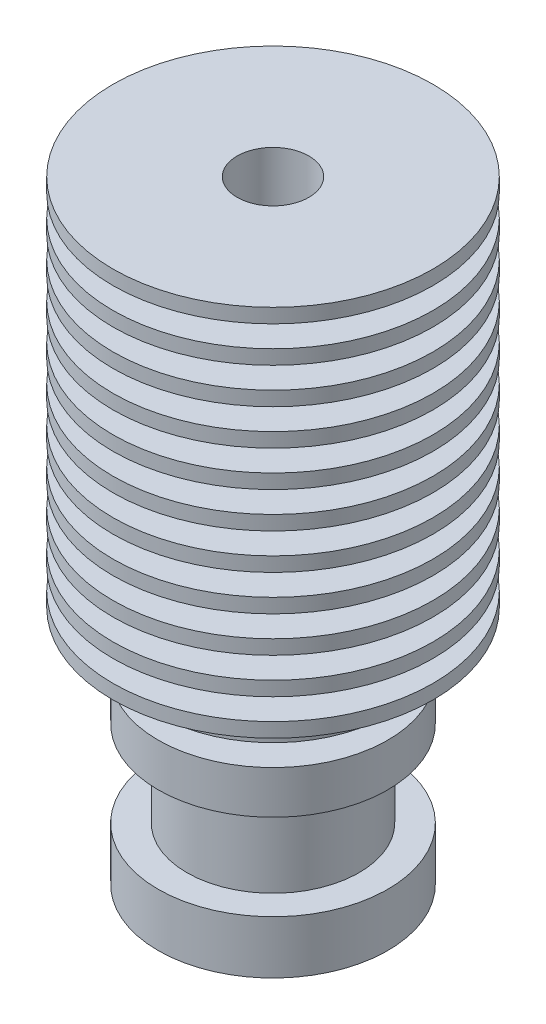
from build123d import *

# Parameters (mm, degrees)
ESQUISSE1_R                = 8
BOSS_EXTRU_1_DEPTH         = 3.7
ESQUISSE2_R                = 6
BOSS_EXTRU_2_DEPTH         = 6
ESQUISSE3_R                = 8
ESQUISSE3_R_2              = 3.25
BOSS_EXTRU_3_DEPTH         = 3
ESQUISSE4_R                = 4.5
BOSS_EXTRU_4_DEPTH         = 30
BOSS_EXTRU_4_DRAFT         = -3
ENL_V_MAT_EXTRU_1_REACH    = 46.173
ESQUISSE5_R                = 2.1
TROU_TARAUD_M61_D          = 5
TROU_TARAUD_M61_DEPTH      = 17.9
TROU_TARAUD_M61_TIP        = 1.502151548
ESQUISSE9_R                = 8
ESQUISSE9_R_2              = 4.25
BOSS_EXTRU_5_DEPTH         = 1
ESQUISSE10_R               = 11.15
ESQUISSE10_R_2             = 4.25
BOSS_EXTRU_6_DEPTH         = 1
R_P_TITION_LIN_AIRE1_COUNT = 11
R_P_TITION_LIN_AIRE1_PITCH = 2.5
TROU_TARAUD_M51_D          = 4.2
TROU_TARAUD_M51_DEPTH      = 12.4
TROU_TARAUD_M51_TIP        = 1.2618073


with BuildPart() as part:
    # Esquisse1 → Boss.-Extru.1 (new body)
    with BuildSketch(Plane(origin=(0, 0, 0), x_dir=(1, 0, 0), z_dir=(0, 1, 0))):
        with Locations(Location((0, 0, 0), (0, 0, 270))):
            Circle(ESQUISSE1_R)
    extrude(amount=BOSS_EXTRU_1_DEPTH)

    # Esquisse2 → Boss.-Extru.2 (add)
    with BuildSketch(Plane(origin=(0, 3.7, 0), x_dir=(1, 0, 0), z_dir=(0, 1, 0))):
        with Locations(Location((0, 0, 0), (0, 0, 270))):
            Circle(ESQUISSE2_R)
    extrude(amount=BOSS_EXTRU_2_DEPTH)

    # Esquisse3 → Boss.-Extru.3 (add)
    with BuildSketch(Plane(origin=(0, 9.7, 0), x_dir=(1, 0, 0), z_dir=(0, 1, 0))):
        with Locations(Location((0, 0, 0), (0, 0, 270))):
            Circle(ESQUISSE3_R)
        with Locations(Location((0, 0, 0), (0, 0, 270))):
            Circle(ESQUISSE3_R_2, mode=Mode.SUBTRACT)
    extrude(amount=BOSS_EXTRU_3_DEPTH)


with BuildPart() as boss_extru_4_tool:
    # Esquisse4 → Boss.-Extru.4 (with draft: the straight prism first)
    with BuildSketch(Plane(origin=(0, 12.7, 0), x_dir=(1, 0, 0), z_dir=(0, 1, 0))):
        Circle(ESQUISSE4_R)
    extrude(amount=BOSS_EXTRU_4_DEPTH)
    # Boss.-Extru.4: the draft: its side faces are tilted about the plane it starts from
    boss_extru_4_sides = [boss_extru_4_tool.faces().sort_by_distance(p)[0] for p in [
        (-4.5, 27.7, 0),
    ]]
    draft(boss_extru_4_sides, Plane(origin=(0, 12.7, 0), x_dir=(1, 0, 0), z_dir=(0, 1, 0)), BOSS_EXTRU_4_DRAFT)


with BuildPart() as part_1:
    add(part.part)

    # Boss.-Extru.4: add boss_extru_4_tool
    add(boss_extru_4_tool.part)

    # Esquisse5 → Enlèv. mat.-Extru.1 (cut, up to next)
    with BuildSketch(Plane(origin=(0, 42.7, 0), x_dir=(1, 0, 0), z_dir=(0, 1, 0)), mode=Mode.PRIVATE) as enl_v_mat_extru_1_sk1:
        with Locations(Location((0, 0, 0), (0, 0, 270))):
            Circle(ESQUISSE5_R)
    enl_v_mat_extru_1_tool1 = extrude(enl_v_mat_extru_1_sk1.sketch, amount=-ENL_V_MAT_EXTRU_1_REACH, mode=Mode.PRIVATE) & part_1.part
    add(enl_v_mat_extru_1_tool1.solids().sort_by_distance((0, 42.7, 0))[0], mode=Mode.SUBTRACT)

    # Trou taraudé M61
    with Locations(Plane(origin=(0, 42.7, 0), x_dir=(1, 0, 0), z_dir=(0, 1, 0))):
        with Locations((0, 0)):
            Hole(TROU_TARAUD_M61_D / 2, depth=TROU_TARAUD_M61_DEPTH)
            with Locations((0, 0, -(TROU_TARAUD_M61_DEPTH + TROU_TARAUD_M61_TIP / 2))):  # 118° drill point
                Cone(0, TROU_TARAUD_M61_D / 2, TROU_TARAUD_M61_TIP, mode=Mode.SUBTRACT)

    # Esquisse9 → Boss.-Extru.5 (add)
    with BuildSketch(Plane(origin=(0, 14.2, 0), x_dir=(1, 0, 0), z_dir=(0, 1, 0))):
        with Locations(Location((0, 0, 0), (0, 0, 270))):
            Circle(ESQUISSE9_R)
        Circle(ESQUISSE9_R_2, mode=Mode.SUBTRACT)
    extrude(amount=BOSS_EXTRU_5_DEPTH)

    # Esquisse10 → Boss.-Extru.6 (add)
    with BuildSketch(Plane(origin=(0, 16.7, 0), x_dir=(1, 0, 0), z_dir=(0, 1, 0))):
        with Locations(Location((0, 0, 0), (0, 0, 270))):
            Circle(ESQUISSE10_R)
        Circle(ESQUISSE10_R_2, mode=Mode.SUBTRACT)
    boss_extru_6 = extrude(amount=BOSS_EXTRU_6_DEPTH)

    # Répétition linéaire1: Boss.-Extru.6 ×11
    with Locations(*[(0, i * R_P_TITION_LIN_AIRE1_PITCH, 0) for i in range(1, R_P_TITION_LIN_AIRE1_COUNT)]):
        add(boss_extru_6)

    # Trou taraudé M51
    with Locations(Plane(origin=(0, 0, 0), x_dir=(-1, 0, 0), z_dir=(0, -1, 0))):
        with Locations((0, 0)):
            Hole(TROU_TARAUD_M51_D / 2, depth=TROU_TARAUD_M51_DEPTH)
            with Locations((0, 0, -(TROU_TARAUD_M51_DEPTH + TROU_TARAUD_M51_TIP / 2))):  # 118° drill point
                Cone(0, TROU_TARAUD_M51_D / 2, TROU_TARAUD_M51_TIP, mode=Mode.SUBTRACT)


solid = part_1.part
